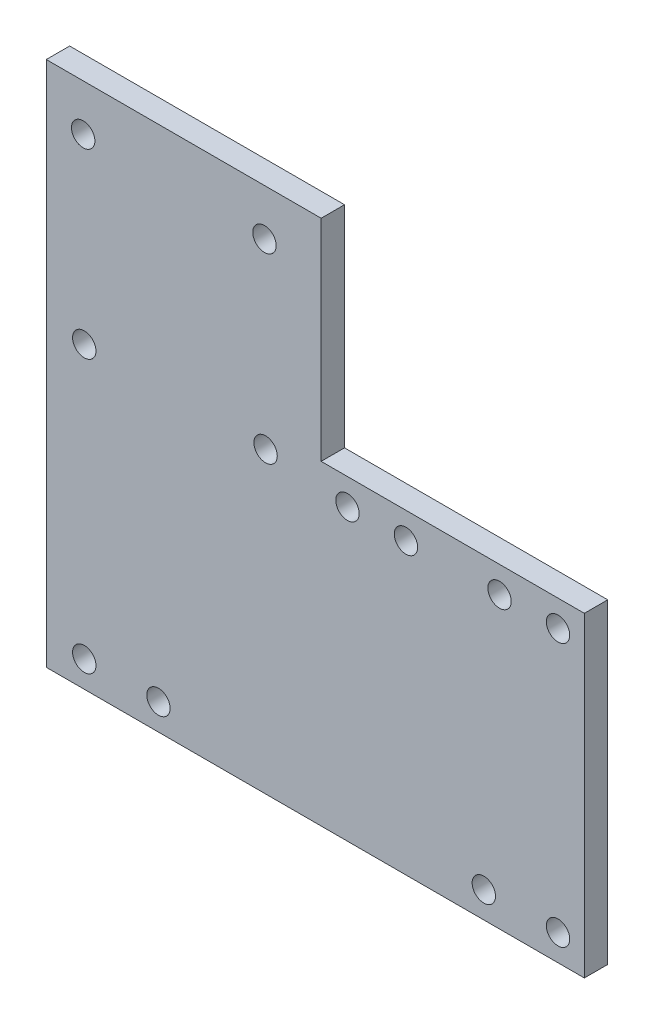
from build123d import *

# Parameters (mm, degrees)
BOSS_EXTRUDE1_DEPTH = 4
SKETCH2_R           = 2
CUT_EXTRUDE1_DEPTH  = 4
SKETCH3_R           = 2
CUT_EXTRUDE2_DEPTH  = 4
SKETCH4_R           = 2
CUT_EXTRUDE3_DEPTH  = 4
SKETCH5_W           = 2
SKETCH5_H           = 90
BOSS_EXTRUDE2_DEPTH = 4
SKETCH6_R           = 2
CUT_EXTRUDE4_DEPTH  = 4


with BuildPart() as part:
    # Sketch1 → Boss-Extrude1 (new body)
    with BuildSketch(Plane.XY):
        Polygon((-45, 27), (-45, 63), (0, 63), (0, 27), (45, 27), (45, -27), (-45, -27), align=None)
    extrude(amount=BOSS_EXTRUDE1_DEPTH)

    # Sketch2 → Cut-Extrude1 (cut)
    with BuildSketch(Plane.XY.offset(4)):
        with Locations((-40.5, -22.5)):
            Circle(SKETCH2_R)
        with Locations((-27.816637329, -22.5)):
            Circle(SKETCH2_R)
        with Locations(Location((27.816637329, -22.5, 0), (0, 0, 180))):
            Circle(SKETCH2_R)
        with Locations(Location((40.5, -22.5, 0), (0, 0, 180))):
            Circle(SKETCH2_R)
        with Locations(Location((30.5, 22.5, 0), (0, 0, 180))):
            Circle(SKETCH2_R)
        with Locations(Location((40.5, 22.5, 0), (0, 0, 180))):
            Circle(SKETCH2_R)
    extrude(amount=-CUT_EXTRUDE1_DEPTH, mode=Mode.SUBTRACT)

    # Sketch3 → Cut-Extrude2 (cut)
    with BuildSketch(Plane.XY.offset(4)):
        with Locations((-40.5, 24.080850084)):
            Circle(SKETCH3_R)
        with Locations((-9.500034607, 24.034529107)):
            Circle(SKETCH3_R)
    extrude(amount=-CUT_EXTRUDE2_DEPTH, mode=Mode.SUBTRACT)

    # Sketch4 → Cut-Extrude3 (cut)
    with BuildSketch(Plane.XY.offset(4)):
        with Locations((-40.690838772, 55.080850084)):
            Circle(SKETCH4_R)
        with Locations((-9.690838772, 55.080850084)):
            Circle(SKETCH4_R)
    extrude(amount=-CUT_EXTRUDE3_DEPTH, mode=Mode.SUBTRACT)

    # Sketch5 → Boss-Extrude2 (add)
    with BuildSketch(Plane.XY.offset(4)):
        with Locations((-46, 18)):
            Rectangle(SKETCH5_W, SKETCH5_H)
    extrude(amount=-BOSS_EXTRUDE2_DEPTH)

    # Sketch6 → Cut-Extrude4 (cut)
    with BuildSketch(Plane.XY.offset(4)):
        with Locations((4.5, 22.5)):
            Circle(SKETCH6_R)
        with Locations((14.5, 22.5)):
            Circle(SKETCH6_R)
    extrude(amount=-CUT_EXTRUDE4_DEPTH, mode=Mode.SUBTRACT)


solid = part.part
